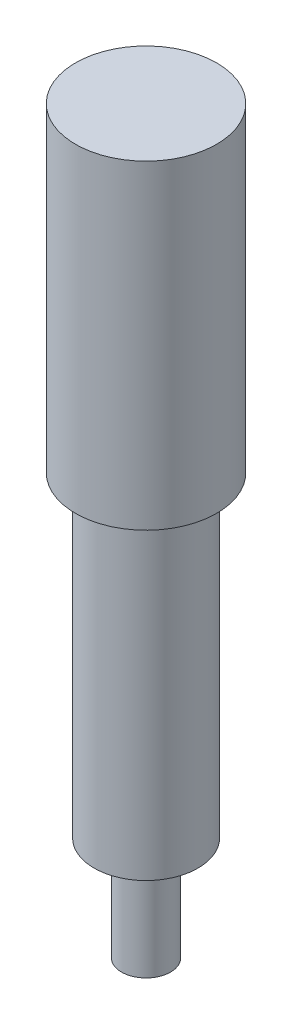
from build123d import *

# Parameters (mm, degrees)
SKETCH2_W   = 12.720955
SKETCH2_H   = 33.02
SKETCH2_W_2 = 5.999999938
SKETCH2_H_2 = 25.4


with BuildPart() as part:
    # Sketch2 → Revolve1 (revolve)
    with BuildSketch(Plane.XY, mode=Mode.PRIVATE) as revolve1_sk:
        with Locations((6.3604775, 86.36)):
            Rectangle(SKETCH2_W, SKETCH2_H)
        Polygon((0, 181.102), (0, 102.87), (12.720955, 102.87), (17.272, 102.87), (17.272, 181.102), align=None)
        Polygon((0, 69.85), (0, 25.4), (5.999999938, 25.4), (12.720955, 25.4), (12.720955, 69.85), align=None)
        with Locations((2.999999969, 12.7)):
            Rectangle(SKETCH2_W_2, SKETCH2_H_2)
    revolve(revolve1_sk.sketch.rotate(Axis((0, 0, 0), (0, 1, 0)), 90), axis=Axis((0, 0, 0), (0, 1, 0)))


solid = part.part
